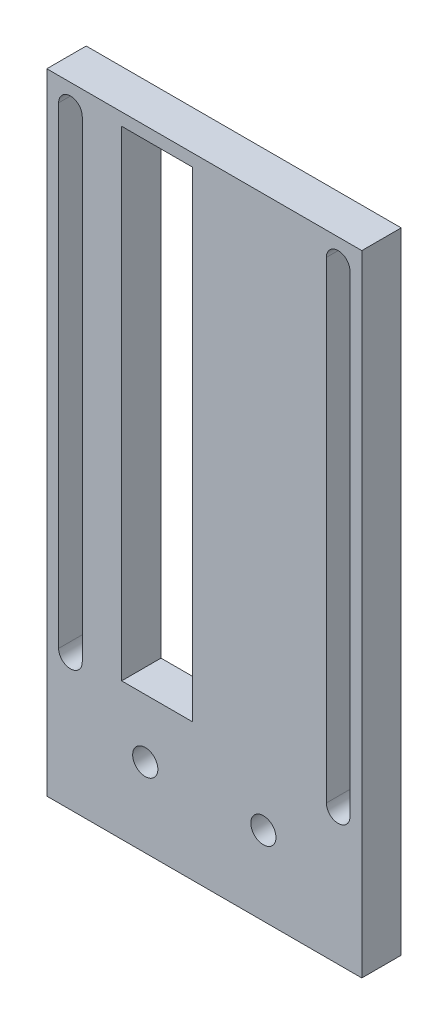
from build123d import *

# Parameters (mm, degrees)
SKETCH1_W           = 40
SKETCH1_H           = 20
SKETCH1_R           = 1.6
BOSS_EXTRUDE1_DEPTH = 5
SKETCH3_W           = 40
SKETCH3_H           = 5
BOSS_EXTRUDE3_DEPTH = 60
CUT_EXTRUDE1_DEPTH  = 73.972597597
SKETCH5_W           = 9
SKETCH5_H           = 60.997272609
CUT_EXTRUDE2_DEPTH  = 73.972597597


with BuildPart() as part:
    # Sketch1 → Boss-Extrude1 (new body)
    with BuildSketch(Plane.XY):
        Rectangle(SKETCH1_W, SKETCH1_H)
        with Locations((-7.5, 0)):
            Circle(SKETCH1_R, mode=Mode.SUBTRACT)
        with Locations((7.5, 0)):
            Circle(SKETCH1_R, mode=Mode.SUBTRACT)
    extrude(amount=BOSS_EXTRUDE1_DEPTH)

    # Sketch3 → Boss-Extrude3 (add)
    with BuildSketch(Plane(origin=(0, 10, 0), x_dir=(1, 0, 0), z_dir=(0, 1, 0))):
        with Locations((0, -2.5)):
            Rectangle(SKETCH3_W, SKETCH3_H)
    extrude(amount=BOSS_EXTRUDE3_DEPTH)

    # Sketch4 → Cut-Extrude1 (cut, through all)
    with BuildSketch(Plane(origin=(0, 0, 0), x_dir=(-1, 0, 0), z_dir=(0, 0, -1))):
        with BuildLine():
            Line((-15.5, 67), (-15.5, 7))
            ThreePointArc((-15.5, 7), (-17, 5.5), (-18.5, 7))
            Line((-18.5, 7), (-18.5, 67))
            ThreePointArc((-18.5, 67), (-17, 68.5), (-15.5, 67))
        make_face()
        with BuildLine():
            Line((18.5, 67), (18.5, 7))
            ThreePointArc((18.5, 7), (17, 5.5), (15.5, 7))
            Line((15.5, 7), (15.5, 67))
            ThreePointArc((15.5, 67), (17, 68.5), (18.5, 67))
        make_face()
    extrude(amount=-CUT_EXTRUDE1_DEPTH, mode=Mode.SUBTRACT)

    # Sketch5 → Cut-Extrude2 (cut, through all)
    with BuildSketch(Plane(origin=(0, 0, 0), x_dir=(-1, 0, 0), z_dir=(0, 0, -1))):
        with Locations((6, 37.926958335)):
            Rectangle(SKETCH5_W, SKETCH5_H)
    extrude(amount=-CUT_EXTRUDE2_DEPTH, mode=Mode.SUBTRACT)


solid = part.part
